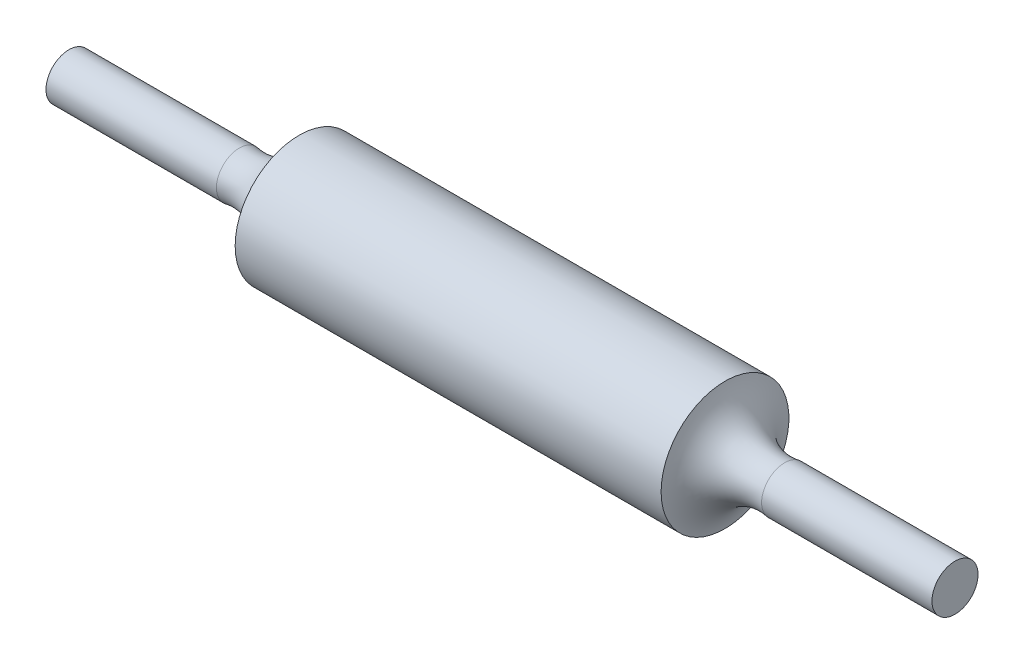
from build123d import *


with BuildPart() as part:
    # Esboço1 → Revolução1 (revolve)
    with BuildSketch(Plane(origin=(0, 0, 0), x_dir=(1, 0, 0), z_dir=(0, 1, 0))):
        with BuildLine():
            Line((-25, -7.5), (25, -7.5))
            ThreePointArc((25, -7.5), (27.50675077, -3.65233677), (32, -2.704168477))
            Line((32, -2.704168477), (52, -2.704168477))
            Line((52, -2.704168477), (52, 0))
            Line((52, 0), (-52, 0))
            Line((-52, 0), (-52, -2.704168477))
            Line((-52, -2.704168477), (-32, -2.704168477))
            ThreePointArc((-32, -2.704168477), (-27.50675077, -3.65233677), (-25, -7.5))
        make_face()
    revolve(axis=Axis((-4.5, 0, 0), (1, 0, 0)))


solid = part.part
